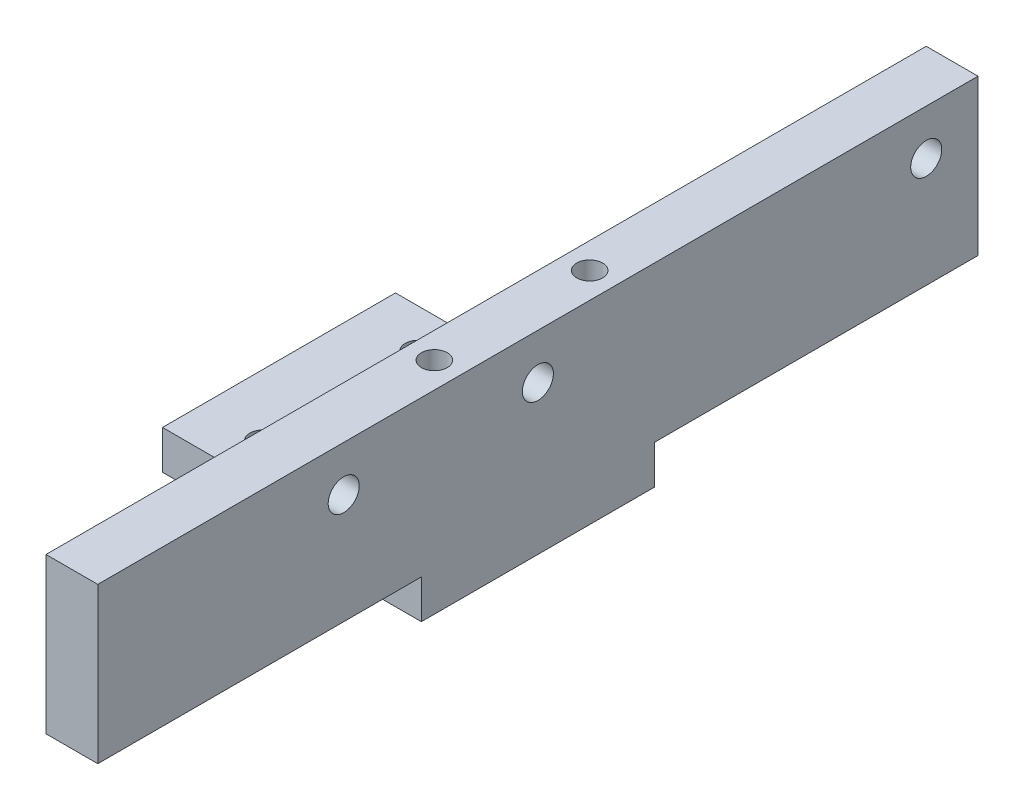
from build123d import *

# Parameters (mm, degrees)
SKETCH_1_W          = 20
SKETCH_1_H          = 18
EXTRUDE_1_DEPTH     = 3
SKETCH_2_W          = 4
SKETCH_2_H          = 18
EXTRUDE_2_DEPTH     = 12
SKETCH_4_R          = 1
CUT_EXTRUDE_1_DEPTH = 35.263683398
SKETCH_5_R          = 1
CUT_EXTRUDE_2_DEPTH = 5
SKETCH_6_W          = 4
SKETCH_6_H          = 12
EXTRUDE_3_DEPTH     = 25
SKETCH_7_W          = 4
SKETCH_7_H          = 12
EXTRUDE_4_DEPTH     = 25
SKETCH_8_R          = 1.2
CUT_EXTRUDE_3_DEPTH = 4


with BuildPart() as part:
    # 草图1 → 凸台-拉伸1 (new body)
    with BuildSketch(Plane(origin=(0, 0, 0), x_dir=(1, 0, 0), z_dir=(0, 1, 0))):
        with Locations((15, -9)):
            Rectangle(SKETCH_1_W, SKETCH_1_H)
    extrude(amount=EXTRUDE_1_DEPTH)

    # 草图2 → 凸台-拉伸2 (add)
    with BuildSketch(Plane(origin=(0, 3, 0), x_dir=(1, 0, 0), z_dir=(0, 1, 0))):
        with Locations((23, -9)):
            Rectangle(SKETCH_2_W, SKETCH_2_H)
    extrude(amount=EXTRUDE_2_DEPTH)

    # 草图4 → 切除-拉伸1 (cut, through all)
    with BuildSketch(Plane.XZ):
        with Locations(Location((17.75, 15, 0), (0, 0, 270))):
            Circle(SKETCH_4_R)
        with Locations(Location((17.75, 3, 0), (0, 0, 270))):
            Circle(SKETCH_4_R)
        with Locations(Location((9.75, 3, 0), (0, 0, 270))):
            Circle(SKETCH_4_R)
        with Locations(Location((9.75, 15, 0), (0, 0, 270))):
            Circle(SKETCH_4_R)
    extrude(amount=-CUT_EXTRUDE_1_DEPTH, mode=Mode.SUBTRACT)

    # 草图5 → 切除-拉伸2 (cut)
    with BuildSketch(Plane(origin=(0, 15, 0), x_dir=(1, 0, 0), z_dir=(0, 1, 0))):
        with Locations(Location((23, -15, 0), (0, 0, 270))):
            Circle(SKETCH_5_R)
        with Locations(Location((23, -3, 0), (0, 0, 270))):
            Circle(SKETCH_5_R)
    extrude(amount=-CUT_EXTRUDE_2_DEPTH, mode=Mode.SUBTRACT)

    # 草图6 → 凸台-拉伸3 (add)
    with BuildSketch(Plane.XY.offset(18)):
        with Locations((23, 9)):
            Rectangle(SKETCH_6_W, SKETCH_6_H)
    extrude(amount=EXTRUDE_3_DEPTH)

    # 草图7 → 凸台-拉伸4 (add)
    with BuildSketch(Plane(origin=(0, 0, 0), x_dir=(-1, 0, 0), z_dir=(0, 0, -1))):
        with Locations((-23, 9)):
            Rectangle(SKETCH_7_W, SKETCH_7_H)
    extrude(amount=EXTRUDE_4_DEPTH)

    # 草图8 → 切除-拉伸3 (cut)
    with BuildSketch(Plane.ZY.offset(-21)):
        with Locations((-36, 11.5)):
            Circle(SKETCH_8_R)
        with Locations((-21, 11.5)):
            Circle(SKETCH_8_R)
        with Locations((9, 11.5)):
            Circle(SKETCH_8_R)
        with Locations((24, 11.5)):
            Circle(SKETCH_8_R)
    extrude(amount=-CUT_EXTRUDE_3_DEPTH, mode=Mode.SUBTRACT)


solid = part.part
